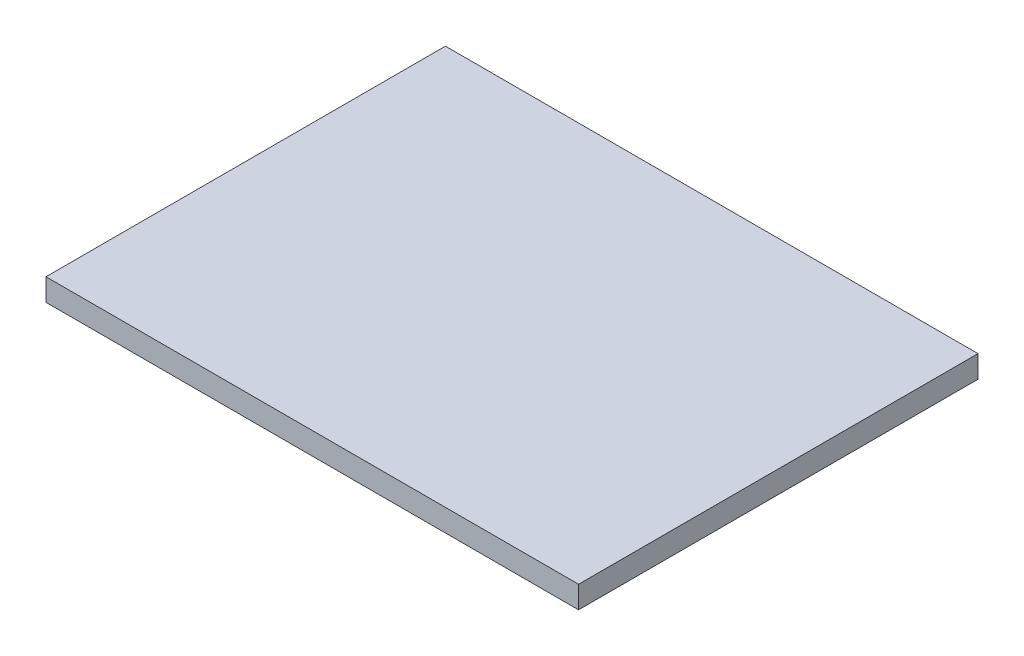
from build123d import *

# Parameters (mm, degrees)
SKETCH1_W           = 120
SKETCH1_H           = 90
BOSS_EXTRUDE1_DEPTH = 5


with BuildPart() as part:
    # Sketch1 → Boss-Extrude1 (new body)
    with BuildSketch(Plane(origin=(0, 0, 0), x_dir=(1, 0, 0), z_dir=(0, 1, 0))):
        Rectangle(SKETCH1_W, SKETCH1_H)
    extrude(amount=BOSS_EXTRUDE1_DEPTH)


solid = part.part
